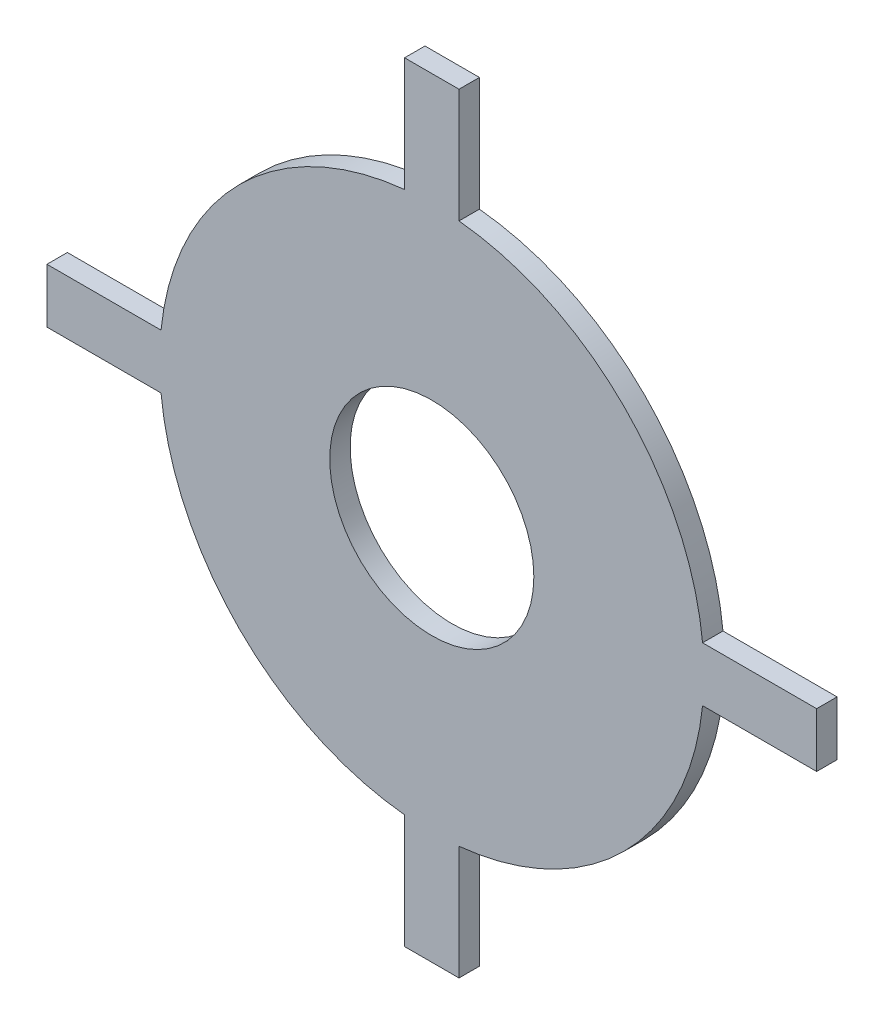
from build123d import *

# Parameters (mm, degrees)
SKETCH_1_R      = 20
SKETCH_1_R_2    = 7.5
EXTRUDE_1_DEPTH = 1.5
SKETCH_2_W      = 9.284271247
SKETCH_2_H      = 4
SKETCH_2_W_2    = 4
SKETCH_2_H_2    = 9.284271247
EXTRUDE_2_DEPTH = 1.5


with BuildPart() as part:
    # 草图1 → 凸台-拉伸1 (new body)
    with BuildSketch(Plane.XY):
        Circle(SKETCH_1_R)
        Circle(SKETCH_1_R_2, mode=Mode.SUBTRACT)
    extrude(amount=EXTRUDE_1_DEPTH)

    # 草图2 → 凸台-拉伸2 (add)
    with BuildSketch(Plane.XY):
        with Locations((23.642135624, 0)):
            Rectangle(SKETCH_2_W, SKETCH_2_H)
        with Locations((0, 23.642135624)):
            Rectangle(SKETCH_2_W_2, SKETCH_2_H_2)
        with Locations((-23.642135624, 0)):
            Rectangle(SKETCH_2_W, SKETCH_2_H)
        with Locations((0, -23.642135624)):
            Rectangle(SKETCH_2_W_2, SKETCH_2_H_2)
    extrude(amount=EXTRUDE_2_DEPTH)


solid = part.part
